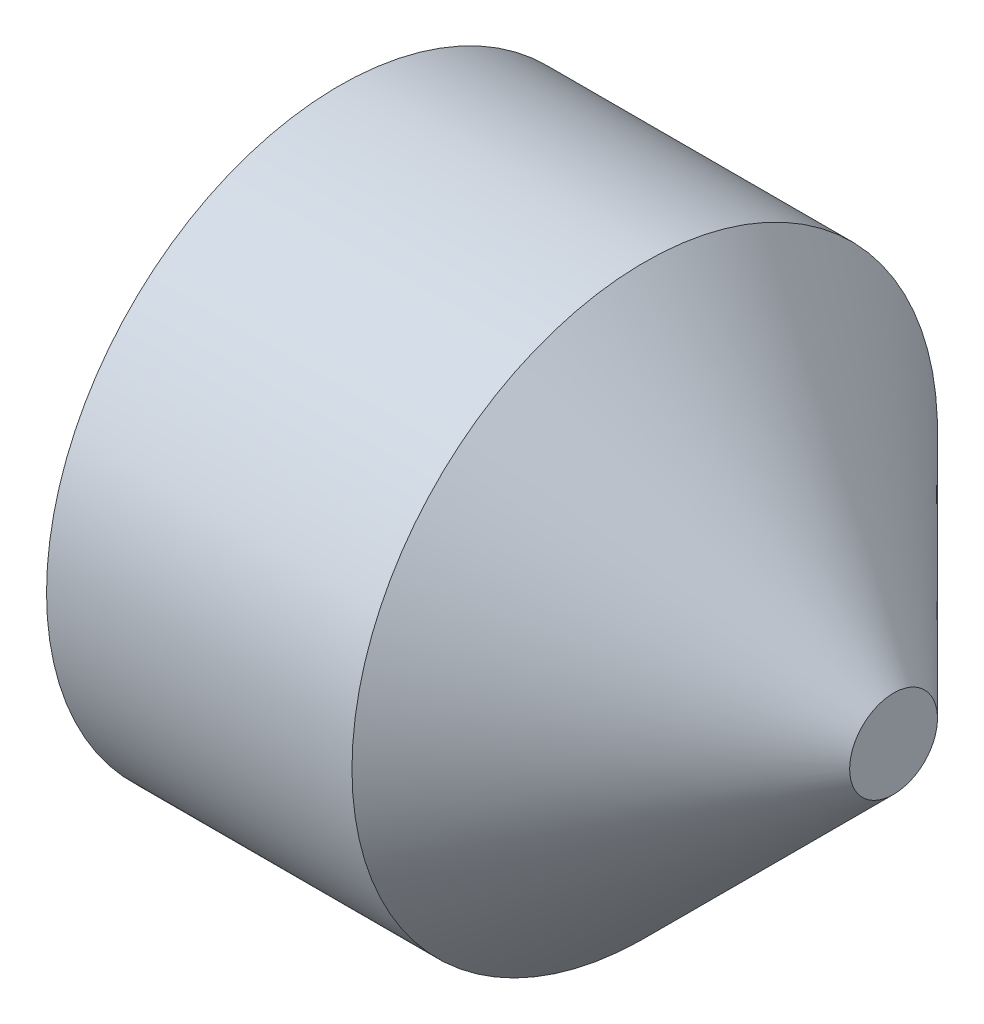
from build123d import *

# Parameters (mm, degrees)
HEX_2_DEPTH = 3.5


with BuildPart() as part:
    # BodySke → BaseBody (revolve)
    with BuildSketch(Plane.XY, mode=Mode.PRIVATE) as basebody_sk:
        Polygon((0, 0), (0, 2.4455), (0.320140724, 3), (3.45, 3), (6, 0.45), (6, 0), align=None)
    revolve(basebody_sk.sketch.rotate(Axis((-12.7, 0, 0), (1, 0, 0)), 90), axis=Axis((-12.7, 0, 0), (1, 0, 0)))

    # Sketch2 → Hex 2 (cut)
    with BuildSketch(Plane.ZY):
        Polygon((0.866025404, 1.5), (-0.866025404, 1.5), (-1.732050808, 0), (-0.866025404, -1.5), (0.866025404, -1.5), (1.732050808, 0), align=None)
    extrude(amount=-HEX_2_DEPTH, mode=Mode.SUBTRACT)


solid = part.part
